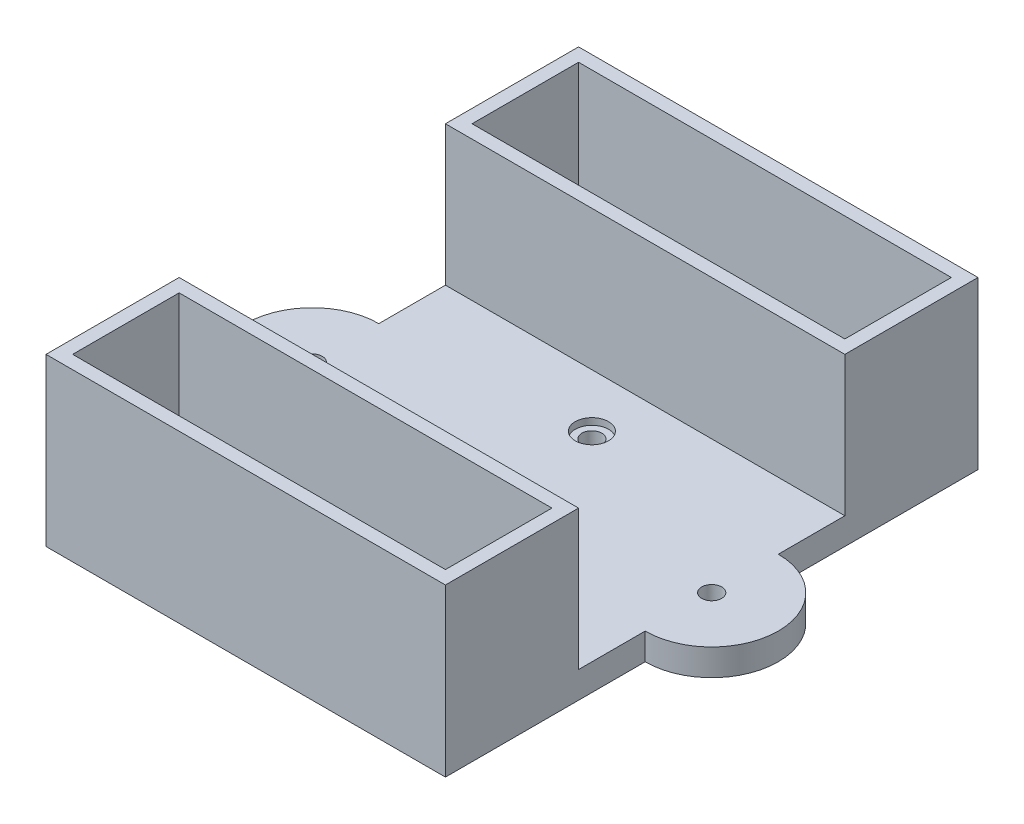
from build123d import *

# Parameters (mm, degrees)
SKETCH1_R           = 1.5
SKETCH1_R_2         = 1
SKETCH1_W           = 36
SKETCH1_H           = 16
BOSS_EXTRUDE1_DEPTH = 4
SKETCH3_W           = 60
SKETCH3_H           = 20
SKETCH3_W_2         = 56
SKETCH3_H_2         = 16
BOSS_EXTRUDE2_DEPTH = 21
SKETCH4_R           = 2.5
CUT_EXTRUDE1_DEPTH  = 1
SKETCH5_W           = 56
SKETCH5_H           = 16
CUT_EXTRUDE2_DEPTH  = 23


with BuildPart() as part:
    # Sketch1 → Boss-Extrude1 (new body)
    with BuildSketch(Plane(origin=(0, 0, 0), x_dir=(1, 0, 0), z_dir=(0, 1, 0))):
        with BuildLine():
            Line((-30, -40), (30, -40))
            Line((30, -40), (30, -10))
            ThreePointArc((30, -10), (40, 0), (30, 10))
            Line((30, 10), (30, 40))
            Line((30, 40), (-30, 40))
            Line((-30, 40), (-30, 10))
            ThreePointArc((-30, 10), (-40, 0), (-30, -10))
            Line((-30, -10), (-30, -40))
        make_face()
        with Locations(Location((30, 0, 0), (0, 0, 90))):
            Circle(SKETCH1_R, mode=Mode.SUBTRACT)
        with Locations(Location((-30, 0, 0), (0, 0, 270))):
            Circle(SKETCH1_R, mode=Mode.SUBTRACT)
        with Locations(Location((0, 12, 0), (0, 0, 270))):
            Circle(SKETCH1_R, mode=Mode.SUBTRACT)
        with Locations(Location((0, -12, 0), (0, 0, 90))):
            Circle(SKETCH1_R, mode=Mode.SUBTRACT)
        with Locations(Location((-21.5, 30, 0), (0, 0, 270))):
            Circle(SKETCH1_R_2, mode=Mode.SUBTRACT)
        with Locations(Location((21.5, 30, 0), (0, 0, 90))):
            Circle(SKETCH1_R_2, mode=Mode.SUBTRACT)
        with Locations(Location((21.5, -30, 0), (0, 0, 270))):
            Circle(SKETCH1_R_2, mode=Mode.SUBTRACT)
        with Locations(Location((-21.5, -30, 0), (0, 0, 90))):
            Circle(SKETCH1_R_2, mode=Mode.SUBTRACT)
        with Locations((0, -30)):
            Rectangle(SKETCH1_W, SKETCH1_H, mode=Mode.SUBTRACT)
        with Locations((0, 30)):
            Rectangle(SKETCH1_W, SKETCH1_H, mode=Mode.SUBTRACT)
    extrude(amount=BOSS_EXTRUDE1_DEPTH)

    # Sketch3 → Boss-Extrude2 (add)
    # profile 1 of 2: a face of its own
    with BuildSketch(Plane(origin=(0, 4, 0), x_dir=(1, 0, 0), z_dir=(0, 1, 0))):
        with Locations((0, 30)):
            Rectangle(SKETCH3_W, SKETCH3_H)
        with Locations((0, 30)):
            Rectangle(SKETCH3_W_2, SKETCH3_H_2, mode=Mode.SUBTRACT)
    # profile 2 of 2: a face of its own
    with BuildSketch(Plane(origin=(0, 4, 0), x_dir=(1, 0, 0), z_dir=(0, 1, 0))):
        with Locations((0, -30)):
            Rectangle(SKETCH3_W, SKETCH3_H)
        with Locations((0, -30)):
            Rectangle(SKETCH3_W_2, SKETCH3_H_2, mode=Mode.SUBTRACT)
    extrude(amount=BOSS_EXTRUDE2_DEPTH)

    # Sketch4 → Cut-Extrude1 (cut)
    with BuildSketch(Plane(origin=(0, 4, 0), x_dir=(1, 0, 0), z_dir=(0, 1, 0))):
        with Locations(Location((0, 12, 0), (0, 0, 270))):
            Circle(SKETCH4_R)
        with Locations(Location((0, -12, 0), (0, 0, 90))):
            Circle(SKETCH4_R)
    extrude(amount=-CUT_EXTRUDE1_DEPTH, mode=Mode.SUBTRACT)

    # Sketch5 → Cut-Extrude2 (cut)
    with BuildSketch(Plane(origin=(0, 25, 0), x_dir=(1, 0, 0), z_dir=(0, 1, 0))):
        with Locations((0, 30)):
            Rectangle(SKETCH5_W, SKETCH5_H)
    cut_extrude2 = extrude(amount=-CUT_EXTRUDE2_DEPTH, mode=Mode.SUBTRACT)

    # Mirror1: Cut-Extrude2 across plane
    add(cut_extrude2.mirror(Plane.XY), mode=Mode.SUBTRACT)


solid = part.part
